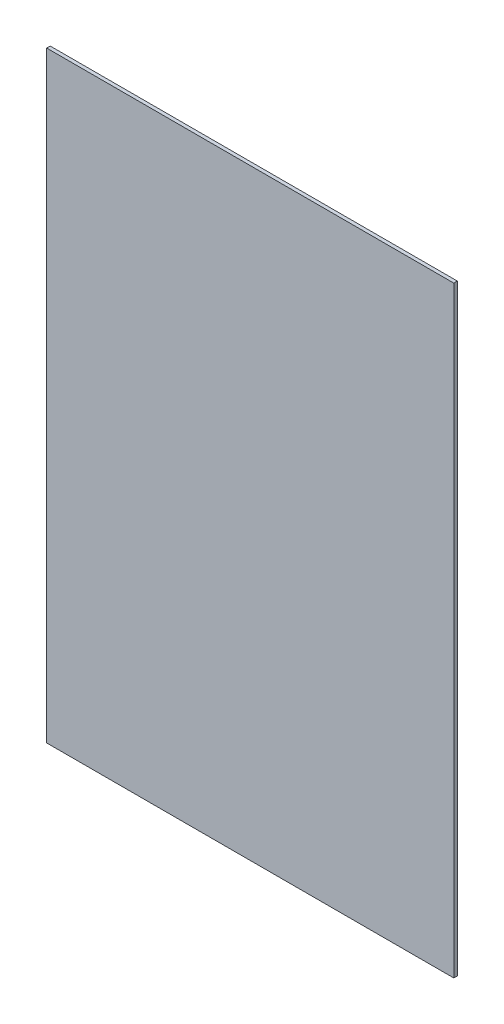
from build123d import *

# Parameters (mm, degrees)
SKETCH2_W           = 230
SKETCH2_H           = 340
BOSS_EXTRUDE1_DEPTH = 2


with BuildPart() as part:
    # Sketch2 → Boss-Extrude1 (new body)
    with BuildSketch(Plane.XY):
        Rectangle(SKETCH2_W, SKETCH2_H)
    extrude(amount=BOSS_EXTRUDE1_DEPTH)


solid = part.part
